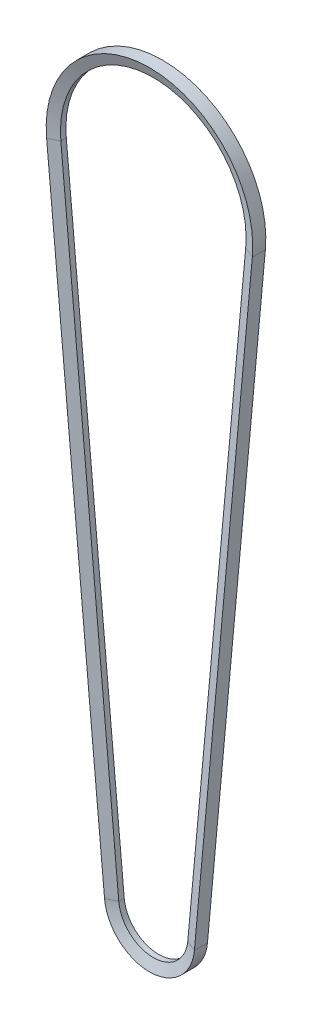
from build123d import *


with BuildPart() as part:
    # Sweep1: sweep along a path in Sketch2
    with BuildLine(Plane.XY) as sweep1_path:
        Line((-25.392658719, -2.337281153), (-69.70533766, 479.083934089))
        ThreePointArc((-69.70533766, 479.083934089), (0, 555.5), (69.705337659, 479.083934089))
        Line((69.705337659, 479.083934089), (25.392658719, -2.337281153))
        ThreePointArc((25.392658719, -2.337281153), (0, -25.5), (-25.392658719, -2.337281153))
    # Sketch3 → Sweep1 (sweep)
    with BuildSketch(Plane(origin=(69.705337659, 479.083934089, 0), x_dir=(-0.9957905379924045, 0.09165808444866114, 0), z_dir=(-0.09165808444866114, -0.9957905379924045, 0))):
        Polygon((-1, -2.088238126), (-1, 2.088238126), (-9, 5), (-9, -5), align=None)
    sweep(path=sweep1_path.line)


solid = part.part
